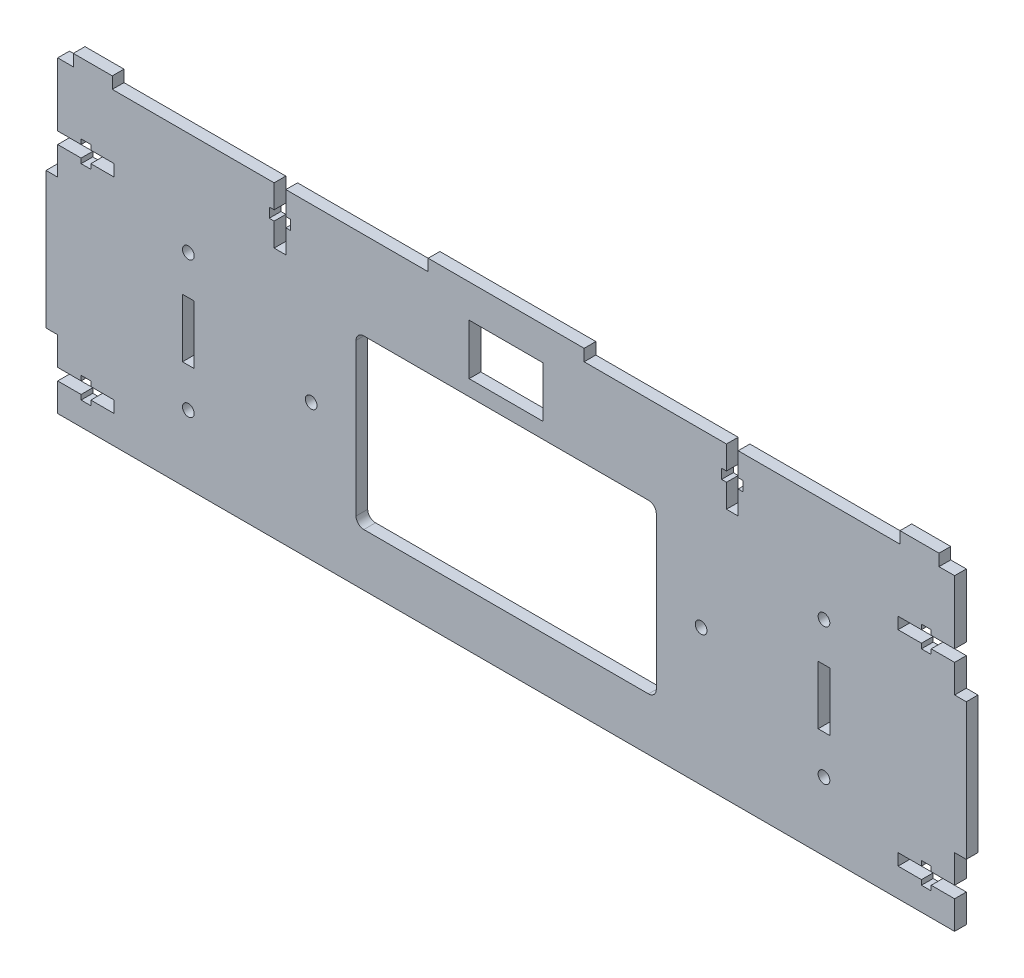
from build123d import *

# Parameters (mm, degrees)
SKETCH_1_W           = 230
SKETCH_1_H           = 79
EXTRUDE_1_DEPTH      = 3
EXTRUDE_2_DEPTH      = 3
EXTRUDE_2_DEPTH_BACK = 233
SKETCH_4_W           = 3
SKETCH_4_H           = 35
SKETCH_2_R           = 1.5
CUT_EXTRUDE_1_DEPTH  = 3
SKETCH_3_R           = 1.5
CUT_EXTRUDE_2_DEPTH  = 3
SKETCH_5_W           = 3
SKETCH_5_H           = 15
CUT_EXTRUDE_3_DEPTH  = 3
CUT_EXTRUDE_4_DEPTH  = 3
SKETCH_8_W           = 10
SKETCH_8_H           = 3
EXTRUDE_3_DEPTH      = 3
SKETCH_9_W           = 40
SKETCH_9_H           = 3
EXTRUDE_4_DEPTH      = 3
CUT_EXTRUDE_5_DEPTH  = 3
CUT_EXTRUDE_6_DEPTH  = 3
SKETCH_12_W          = 19
SKETCH_12_H          = 13
CUT_EXTRUDE_7_DEPTH  = 10


with BuildPart() as part:
    # Эскиз1 → Бобышка-Вытянуть1 (new body)
    with BuildSketch(Plane.XY):
        with Locations((115, 39.5)):
            Rectangle(SKETCH_1_W, SKETCH_1_H)
    extrude(amount=EXTRUDE_1_DEPTH)

    # Эскиз4 → Бобышка-Вытянуть2 (add, two sides: drawn at the far end of the back side and taken through both)
    with BuildSketch(Plane(origin=(230, 0, 0), x_dir=(0, 0, -1), z_dir=(1, 0, 0)).offset(-EXTRUDE_2_DEPTH_BACK)):
        with Locations((-1.5, 35)):
            Rectangle(SKETCH_4_W, SKETCH_4_H)
    extrude(amount=EXTRUDE_2_DEPTH + EXTRUDE_2_DEPTH_BACK)

    # Эскиз2 → Вырез-Вытянуть1 (cut)
    with BuildSketch(Plane.XY.offset(3)):
        with Locations((65, 35)):
            Circle(SKETCH_2_R)
        with Locations((165, 35)):
            Circle(SKETCH_2_R)
    extrude(amount=-CUT_EXTRUDE_1_DEPTH, mode=Mode.SUBTRACT)

    # Эскиз3 → Вырез-Вытянуть2 (cut)
    with BuildSketch(Plane.XY.offset(3)):
        with Locations((33.5, 52.5)):
            Circle(SKETCH_3_R)
        with Locations((196.5, 52.5)):
            Circle(SKETCH_3_R)
        with Locations((196.5, 17.5)):
            Circle(SKETCH_3_R)
        with Locations((33.5, 17.5)):
            Circle(SKETCH_3_R)
    extrude(amount=-CUT_EXTRUDE_2_DEPTH, mode=Mode.SUBTRACT)

    # Эскиз5 → Вырез-Вытянуть3 (cut)
    with BuildSketch(Plane.XY.offset(3)):
        with Locations((33.5, 35)):
            Rectangle(SKETCH_5_W, SKETCH_5_H)
        with Locations((196.5, 35)):
            Rectangle(SKETCH_5_W, SKETCH_5_H)
    extrude(amount=-CUT_EXTRUDE_3_DEPTH, mode=Mode.SUBTRACT)

    # Эскиз6 → Вырез-Вытянуть4 (cut)
    with BuildSketch(Plane.XY.offset(3)):
        Polygon((0, 10.25), (6, 10.25), (6, 11.5), (8.5, 11.5), (8.5, 10.25), (14.5, 10.25), (14.5, 7.25), (8.5, 7.25), (8.5, 6), (6, 6), (6, 7.25), (0, 7.25), align=None)
        Polygon((230, 7.25), (230, 10.25), (224, 10.25), (224, 11.5), (221.5, 11.5), (221.5, 10.25), (215.5, 10.25), (215.5, 7.25), (221.5, 7.25), (221.5, 6), (224, 6), (224, 7.25), align=None)
        Polygon((230, 59.75), (224, 59.75), (224, 58.5), (221.5, 58.5), (221.5, 59.75), (215.5, 59.75), (215.5, 62.75), (221.5, 62.75), (221.5, 64), (224, 64), (224, 62.75), (230, 62.75), align=None)
        Polygon((0, 62.75), (0, 59.75), (6, 59.75), (6, 58.5), (8.5, 58.5), (8.5, 59.75), (14.5, 59.75), (14.5, 62.75), (8.5, 62.75), (8.5, 64), (6, 64), (6, 62.75), align=None)
    extrude(amount=-CUT_EXTRUDE_4_DEPTH, mode=Mode.SUBTRACT)

    # Эскиз8 → Бобышка-Вытянуть3 (add)
    with BuildSketch(Plane(origin=(0, 79, 0), x_dir=(1, 0, 0), z_dir=(0, 1, 0))):
        with Locations((221, -1.5)):
            Rectangle(SKETCH_8_W, SKETCH_8_H)
        with Locations((9, -1.5)):
            Rectangle(SKETCH_8_W, SKETCH_8_H)
    extrude(amount=EXTRUDE_3_DEPTH)

    # Эскиз9 → Бобышка-Вытянуть4 (add)
    with BuildSketch(Plane(origin=(0, 79, 0), x_dir=(1, 0, 0), z_dir=(0, 1, 0))):
        with Locations((115, -1.5)):
            Rectangle(SKETCH_9_W, SKETCH_9_H)
    extrude(amount=EXTRUDE_4_DEPTH)

    # Эскиз10 → Вырез-Вытянуть5 (cut)
    with BuildSketch(Plane.XY.offset(3)):
        Polygon((55.5, 79), (55.5, 73), (54.25, 73), (54.25, 70.5), (55.5, 70.5), (55.5, 64.5), (58.5, 64.5), (58.5, 70.5), (59.75, 70.5), (59.75, 73), (58.5, 73), (58.5, 79), align=None)
        Polygon((171.5, 79), (174.5, 79), (174.5, 73), (175.75, 73), (175.75, 70.5), (174.5, 70.5), (174.5, 64.5), (171.5, 64.5), (171.5, 70.5), (170.25, 70.5), (170.25, 73), (171.5, 73), align=None)
    extrude(amount=-CUT_EXTRUDE_5_DEPTH, mode=Mode.SUBTRACT)

    # Эскиз11 → Вырез-Вытянуть6 (cut)
    with BuildSketch(Plane.XY.offset(3)):
        with BuildLine():
            Line((78.5, 56.5), (151.5, 56.5))
            ThreePointArc((151.5, 56.5), (152.914213562, 55.914213562), (153.5, 54.5))
            Line((153.5, 54.5), (153.5, 15.5))
            ThreePointArc((153.5, 15.5), (152.914213562, 14.085786438), (151.5, 13.5))
            Line((151.5, 13.5), (78.5, 13.5))
            ThreePointArc((78.5, 13.5), (77.085786438, 14.085786438), (76.5, 15.5))
            Line((76.5, 15.5), (76.5, 54.5))
            ThreePointArc((76.5, 54.5), (77.085786438, 55.914213562), (78.5, 56.5))
        make_face()
    extrude(amount=-CUT_EXTRUDE_6_DEPTH, mode=Mode.SUBTRACT)

    # Эскиз12 → Вырез-Вытянуть7 (cut)
    with BuildSketch(Plane(origin=(0, 0, 0), x_dir=(-1, 0, 0), z_dir=(0, 0, -1))):
        with Locations((-115, 67)):
            Rectangle(SKETCH_12_W, SKETCH_12_H)
    extrude(amount=-CUT_EXTRUDE_7_DEPTH, mode=Mode.SUBTRACT)


solid = part.part
